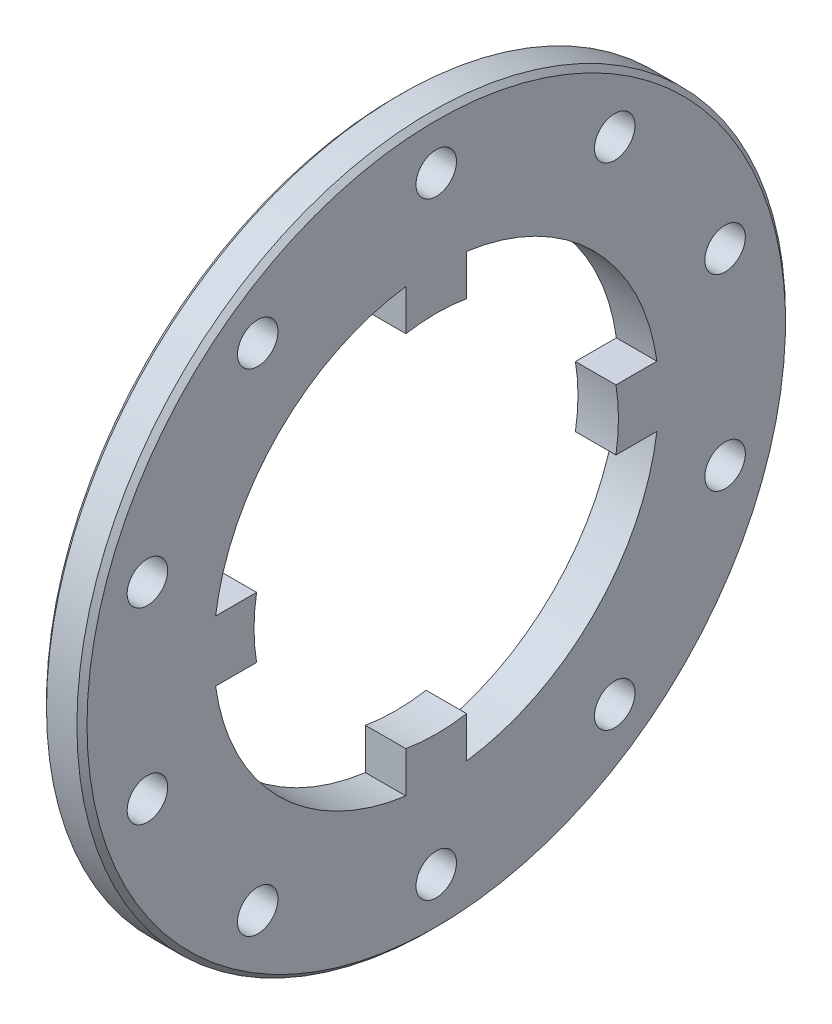
from build123d import *

# Parameters (mm, degrees)
ESQUISSE1_W             = 4
ESQUISSE1_H             = 17
ENL_V_MAT_EXTRU_1_DEPTH = 50.658836072
CHANFREIN1_SIZE         = 0.5
ESQUISSE3_R             = 2
ENL_V_MAT_EXTRU_2_DEPTH = 50.658836072


with BuildPart() as part:
    # Esquisse1 → Base-Révolution (revolve)
    with BuildSketch(Plane.XY, mode=Mode.PRIVATE) as base_r_volution_sk:
        with Locations((2, 26.5)):
            Rectangle(ESQUISSE1_W, ESQUISSE1_H)
    revolve(base_r_volution_sk.sketch.rotate(Axis((0, 0, 0), (1, 0, 0)), 90), axis=Axis((0, 0, 0), (1, 0, 0)))

    # Esquisse2 → Enlèv. mat.-Extru.1 (cut, through all)
    with BuildSketch(Plane.ZY):
        with BuildLine():
            Line((-3, 16), (-3, 21.794494718))
            ThreePointArc((-3, 21.794494718), (-15.556349186, 15.556349186), (-21.794494718, 3))
            Line((-21.794494718, 3), (-16, 3))
            Line((-16, 3), (-16, -3))
            Line((-16, -3), (-21.794494718, -3))
            ThreePointArc((-21.794494718, -3), (-15.556349186, -15.556349186), (-3, -21.794494718))
            Line((-3, -21.794494718), (-3, -16))
            Line((-3, -16), (3, -16))
            Line((3, -16), (3, -21.794494718))
            ThreePointArc((3, -21.794494718), (15.556349186, -15.556349186), (21.794494718, -3))
            Line((21.794494718, -3), (16, -3))
            Line((16, -3), (16, 3))
            Line((16, 3), (21.794494718, 3))
            ThreePointArc((21.794494718, 3), (15.556349186, 15.556349186), (3, 21.794494718))
            Line((3, 21.794494718), (3, 16))
            Line((3, 16), (-3, 16))
        make_face()
    extrude(amount=-ENL_V_MAT_EXTRU_1_DEPTH, mode=Mode.SUBTRACT)

    # Chanfrein1
    chanfrein1_edges = [part.edges().sort_by_distance(p)[0] for p in [
        (0, 0, -35),
        (4, 0, -35),
    ]]
    chamfer(chanfrein1_edges, length=CHANFREIN1_SIZE)

    # Esquisse3 → Enlèv. mat.-Extru.2 (cut, through all)
    with BuildSketch(Plane.ZY):
        with Locations((0, 30)):
            Circle(ESQUISSE3_R)
        with Locations((17.633557569, 24.270509831)):
            Circle(ESQUISSE3_R)
        with Locations((28.531695489, 9.270509831)):
            Circle(ESQUISSE3_R)
        with Locations((28.531695489, -9.270509831)):
            Circle(ESQUISSE3_R)
        with Locations((17.633557569, -24.270509831)):
            Circle(ESQUISSE3_R)
        with Locations((0, -30)):
            Circle(ESQUISSE3_R)
        with Locations((-17.633557569, -24.270509831)):
            Circle(ESQUISSE3_R)
        with Locations((-28.531695489, -9.270509831)):
            Circle(ESQUISSE3_R)
        with Locations((-28.531695489, 9.270509831)):
            Circle(ESQUISSE3_R)
        with Locations((-17.633557569, 24.270509831)):
            Circle(ESQUISSE3_R)
    extrude(amount=-ENL_V_MAT_EXTRU_2_DEPTH, mode=Mode.SUBTRACT)


solid = part.part
